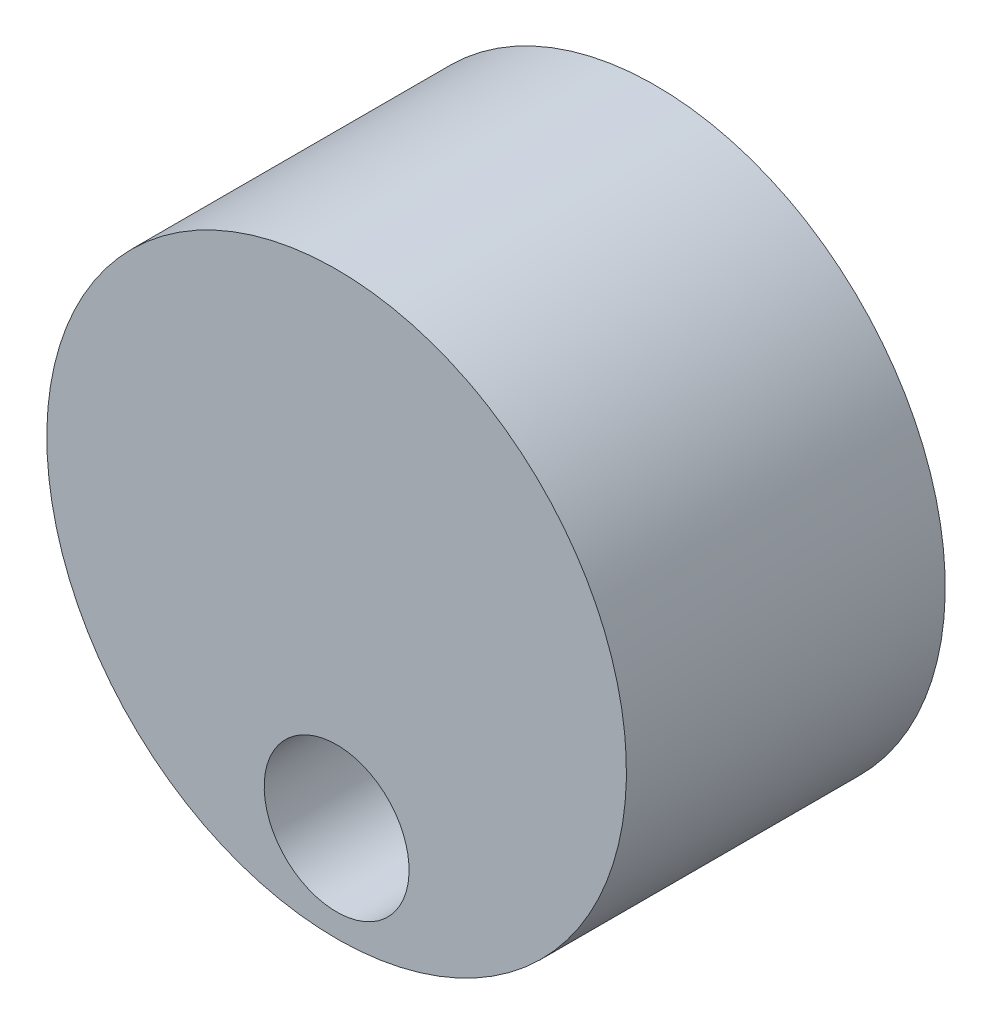
from build123d import *

# Parameters (mm, degrees)
ESQUISSE1_RX       = 12.7
ESQUISSE1_RY       = 12.7
ESQUISSE1_RX_2     = 3.175
ESQUISSE1_RY_2     = 3.175
BOSS_EXTRU_1_DEPTH = 13.97


with BuildPart() as part:
    # Esquisse1 → Boss.-Extru.1 (new body)
    with BuildSketch(Plane.XY):
        with Locations(Location((0, 0), (0, 0, 63.038901355))):
            Ellipse(ESQUISSE1_RX, ESQUISSE1_RY)
        with Locations(Location((0, -8.509), (0, 0, 124.414368361))):
            Ellipse(ESQUISSE1_RX_2, ESQUISSE1_RY_2, mode=Mode.SUBTRACT)
    extrude(amount=BOSS_EXTRU_1_DEPTH)


solid = part.part
